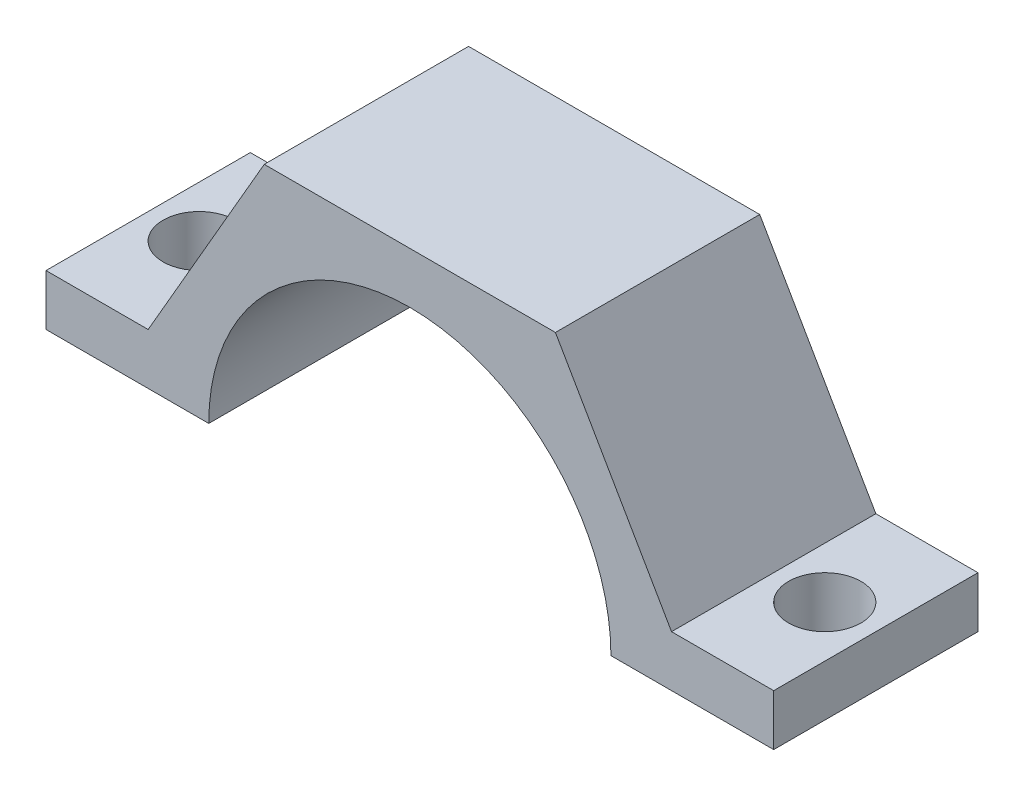
from build123d import *

# Parameters (mm, degrees)
BOSS_EXTRUDE1_DEPTH       = 12.7
F_8_CLEARANCE_HOLE1_D     = 4.4958
F_8_CLEARANCE_HOLE1_DEPTH = 61.468
F_8_CLEARANCE_HOLE1_TIP   = 1.350674586


with BuildPart() as part:
    # Sketch2 → Boss-Extrude1 (new body)
    with BuildSketch(Plane.XY):
        with BuildLine():
            Line((12.5, 0), (22.616843834, 0))
            Line((22.616843834, 0), (22.616843834, 3.175))
            Line((22.616843834, 3.175), (16.266843834, 3.175))
            Line((16.266843834, 3.175), (9.04996547, 15.675))
            Line((9.04996547, 15.675), (-9.04996547, 15.675))
            Line((-9.04996547, 15.675), (-16.266843834, 3.175))
            Line((-16.266843834, 3.175), (-22.616843834, 3.175))
            Line((-22.616843834, 3.175), (-22.616843834, 0))
            Line((-22.616843834, 0), (-12.5, 0))
            ThreePointArc((-12.5, 0), (0, 12.5), (12.5, 0))
        make_face()
    extrude(amount=BOSS_EXTRUDE1_DEPTH)

    # #8 Clearance Hole1
    with Locations(Plane(origin=(0, 3.175, 0), x_dir=(1, 0, 0), z_dir=(0, 1, 0))):
        with Locations((19.441843834, -6.35), (-19.441843834, -6.35)):
            Hole(F_8_CLEARANCE_HOLE1_D / 2, depth=F_8_CLEARANCE_HOLE1_DEPTH)
            with Locations((0, 0, -(F_8_CLEARANCE_HOLE1_DEPTH + F_8_CLEARANCE_HOLE1_TIP / 2))):  # 118° drill point
                Cone(0, F_8_CLEARANCE_HOLE1_D / 2, F_8_CLEARANCE_HOLE1_TIP, mode=Mode.SUBTRACT)


solid = part.part
